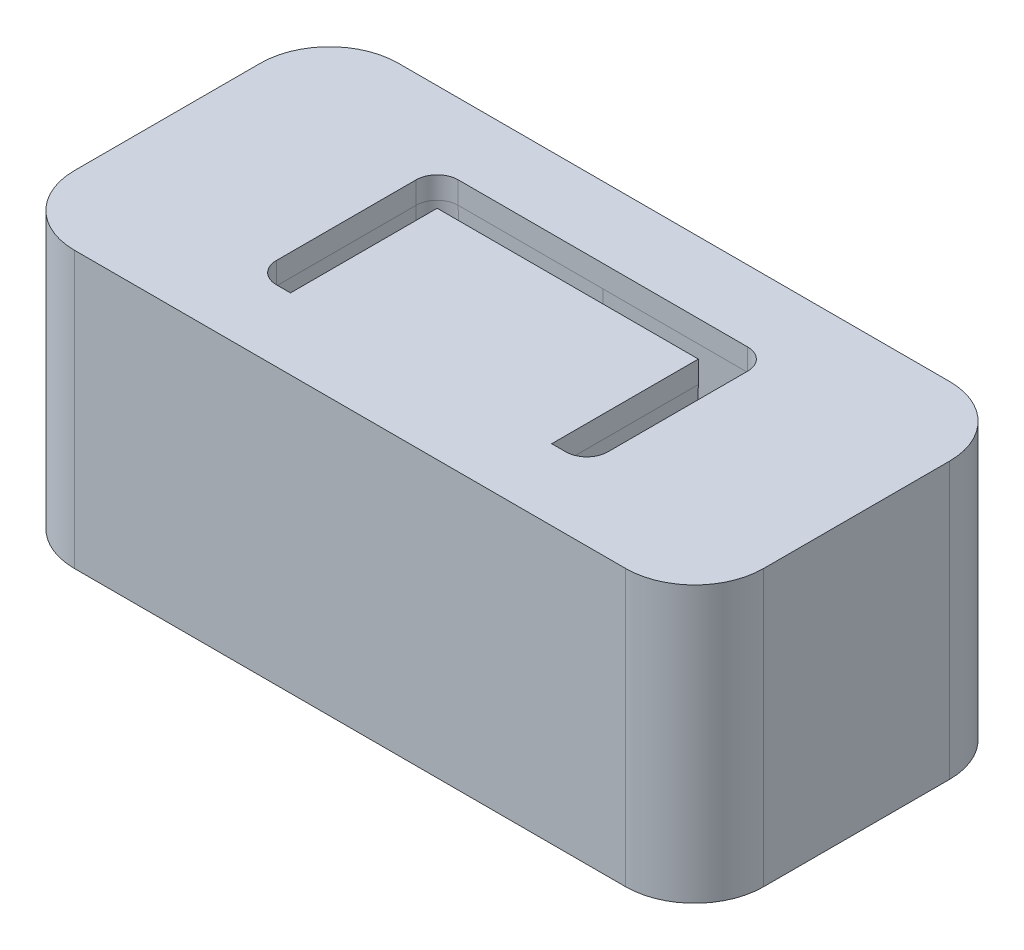
from build123d import *

# Parameters (mm, degrees)
SKETCH2_W                   = 100
SKETCH2_H                   = 47
BOSS_EXTRUDE1_DEPTH         = 40
FILLET1_R                   = 10
CUT_EXTRUDE1_REACH          = 70.207
M6_TAPPED_HOLE1_D           = 5
M6_TAPPED_HOLE1_DEPTH       = 17
M6_TAPPED_HOLE1_CSINK_D     = 6.05
M6_TAPPED_HOLE1_CSINK_ANGLE = 90
M6_TAPPED_HOLE1_TIP         = 1.502151548


with BuildPart() as part:
    # Sketch2 → Boss-Extrude1 (new body)
    with BuildSketch(Plane(origin=(0, 0, 0), x_dir=(1, 0, 0), z_dir=(0, 1, 0))):
        Rectangle(SKETCH2_W, SKETCH2_H)
    extrude(amount=-BOSS_EXTRUDE1_DEPTH)

    # Fillet1
    fillet1_edges = [part.edges().sort_by_distance(p)[0] for p in [
        (50, -20, 23.5),
        (-50, -20, 23.5),
        (-50, -20, -23.5),
        (50, -20, -23.5),
    ]]
    fillet(fillet1_edges, radius=FILLET1_R)

    # Sketch3 → Cut-Extrude1 (cut, up to next)
    with BuildSketch(Plane(origin=(0, 0, 0), x_dir=(1, 0, 0), z_dir=(0, 1, 0)), mode=Mode.PRIVATE) as cut_extrude1_sk1:
        with BuildLine():
            Line((24.05, -10.14), (24.05, 10.14))
            ThreePointArc((24.05, 10.14), (23.156675683, 12.296675683), (21, 13.19))
            Line((21, 13.19), (-21, 13.19))
            ThreePointArc((-21, 13.19), (-23.156675683, 12.296675683), (-24.05, 10.14))
            Line((-24.05, 10.14), (-24.05, -10.14))
            ThreePointArc((-24.05, -10.14), (-23.156675683, -12.296675683), (-21, -13.19))
            Line((-21, -13.19), (-18.95, -13.19))
            Line((-18.95, -13.19), (-18.95, 8.09))
            Line((-18.95, 8.09), (18.95, 8.09))
            Line((18.95, 8.09), (18.95, -13.19))
            Line((18.95, -13.19), (21, -13.19))
            ThreePointArc((21, -13.19), (23.156675683, -12.296675683), (24.05, -10.14))
        make_face()
    cut_extrude1_tool1 = extrude(cut_extrude1_sk1.sketch, amount=-CUT_EXTRUDE1_REACH, mode=Mode.PRIVATE) & part.part
    add(cut_extrude1_tool1.solids().sort_by_distance((23.50141, 0, 0))[0], mode=Mode.SUBTRACT)

    # M6 Tapped Hole1
    with Locations(Plane(origin=(0, -40, 0), x_dir=(-1, 0, 0), z_dir=(0, -1, 0))):
        with Locations((-43, 16.5), (43, 16.5), (43, -16.5), (-43, -16.5)):
            CounterSinkHole(M6_TAPPED_HOLE1_D / 2, M6_TAPPED_HOLE1_CSINK_D / 2, depth=M6_TAPPED_HOLE1_DEPTH, counter_sink_angle=M6_TAPPED_HOLE1_CSINK_ANGLE)
            with Locations((0, 0, -(M6_TAPPED_HOLE1_DEPTH + M6_TAPPED_HOLE1_TIP / 2))):  # 118° drill point
                Cone(0, M6_TAPPED_HOLE1_D / 2, M6_TAPPED_HOLE1_TIP, mode=Mode.SUBTRACT)

    # Cut-Sweep1: sweep along a path in Sketch8
    with BuildLine(Plane(origin=(0, 0, 0), x_dir=(1, 0, 0), z_dir=(0, 1, 0))) as cut_sweep1_path:
        Line((18.95, 8.09), (18.95, -13.19))
        Line((18.95, -13.19), (21, -13.19))
        ThreePointArc((21, -13.19), (23.156675683, -12.296675683), (24.05, -10.14))
        Line((24.05, -10.14), (24.05, 10.14))
        ThreePointArc((24.05, 10.14), (23.156675683, 12.296675683), (21, 13.19))
        Line((21, 13.19), (-21, 13.19))
        ThreePointArc((-21, 13.19), (-23.156675683, 12.296675683), (-24.05, 10.14))
        Line((-24.05, 10.14), (-24.05, -10.14))
        ThreePointArc((-24.05, -10.14), (-23.156675683, -12.296675683), (-21, -13.19))
        Line((-21, -13.19), (-18.95, -13.19))
        Line((-18.95, -13.19), (-18.95, 8.09))
        Line((-18.95, 8.09), (18.95, 8.09))
    # Sketch7 → Cut-Sweep1 (sweep, cut)
    with BuildSketch(Plane(origin=(0, 0, 0), x_dir=(0, 0, -1), z_dir=(1, 0, 0))):
        Polygon((13.19, -3.2), (13.832346389, -40), (13.19, -40), align=None)
    sweep(path=cut_sweep1_path.line, transition=Transition.RIGHT, mode=Mode.SUBTRACT)


solid = part.part
